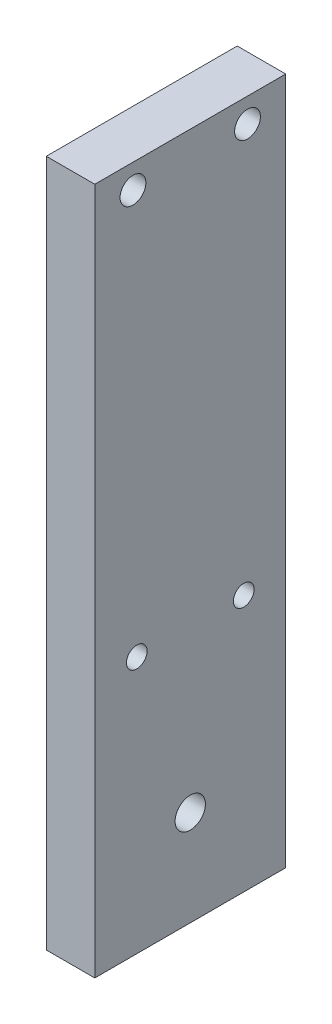
from build123d import *

# Parameters (mm, degrees)
CROQUIS1_W                    = 12.7
CROQUIS1_H                    = 180
SALIENTE_EXTRUIR1_DEPTH       = 25
TALADRO_ROSCADO_3_8_161_D     = 7.9375
TALADRO_DE_MARGEN_PARA_1_41_D = 6.7564
TALADRO_ROSCADO_1_4_281_D     = 5.4102


with BuildPart() as part:
    # Croquis1 → Saliente-Extruir1 (new, symmetric)
    with BuildSketch(Plane.XY):
        Rectangle(CROQUIS1_W, CROQUIS1_H)
    extrude(amount=SALIENTE_EXTRUIR1_DEPTH, both=True)

    # Taladro roscado 3/8-161 (through all)
    with Locations(Plane(origin=(6.35, 0, 0), x_dir=(0, 0, -1), z_dir=(1, 0, 0))):
        with Locations((0, -65)):
            Hole(TALADRO_ROSCADO_3_8_161_D / 2)

    # Taladro de margen para 1/41 (through all)
    with Locations(Plane.ZY.offset(6.35)):
        with Locations((-15, 83.65), (15, 83.65)):
            Hole(TALADRO_DE_MARGEN_PARA_1_41_D / 2)

    # Taladro roscado 1/4-281 (through all)
    with Locations(Plane(origin=(6.35, 0, 0), x_dir=(0, 0, -1), z_dir=(1, 0, 0))):
        with Locations((14, -22.7), (-14, -22.7)):
            Hole(TALADRO_ROSCADO_1_4_281_D / 2)


solid = part.part
